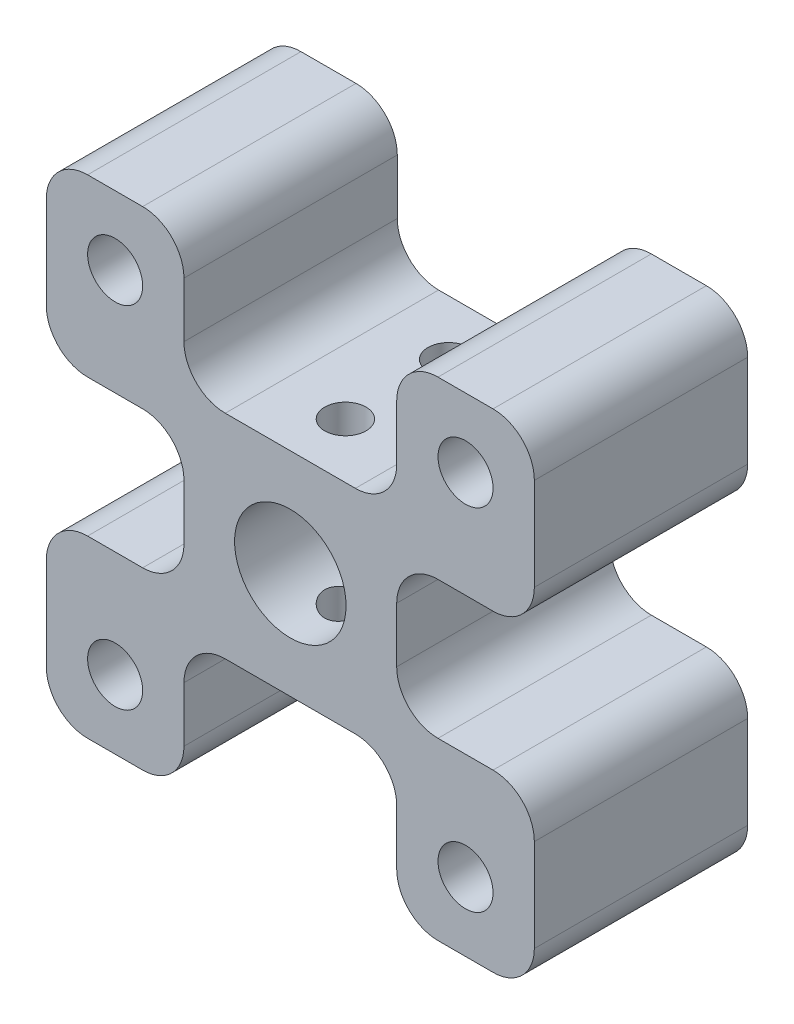
from build123d import *

# Parameters (mm, degrees)
SKETCH_1_R          = 2
SKETCH_1_R_2        = 4.05
EXTRUDE_1_DEPTH     = 15.5
FILLET_3_R          = 3
SKETCH_3_R          = 1.5
CUT_EXTRUDE_2_DEPTH = 35.677503091


with BuildPart() as part:
    # ｽｹｯﾁ1 → ﾎﾞｽ - 押し出し1 (new body)
    with BuildSketch(Plane.XY):
        Polygon((-7.727922061, 17.727922061), (-7.727922061, 7.727922061), (7.727922061, 7.727922061), (7.727922061, 17.727922061), (17.727922061, 17.727922061), (17.727922061, 5), (7.727922061, 5), (7.727922061, -5), (17.727922061, -5), (17.727922061, -17.727922061), (7.727922061, -17.727922061), (7.727922061, -7.727922061), (-7.727922061, -7.727922061), (-7.727922061, -17.727922061), (-17.727922061, -17.727922061), (-17.727922061, -5), (-7.727922061, -5), (-7.727922061, 5), (-17.727922061, 5), (-17.727922061, 17.727922061), align=None)
        with Locations((-12.727922061, 12.727922061)):
            Circle(SKETCH_1_R, mode=Mode.SUBTRACT)
        with Locations((12.727922061, 12.727922061)):
            Circle(SKETCH_1_R, mode=Mode.SUBTRACT)
        with Locations((12.727922061, -12.727922061)):
            Circle(SKETCH_1_R, mode=Mode.SUBTRACT)
        with Locations((-12.727922061, -12.727922061)):
            Circle(SKETCH_1_R, mode=Mode.SUBTRACT)
        Circle(SKETCH_1_R_2, mode=Mode.SUBTRACT)
    extrude(amount=EXTRUDE_1_DEPTH)

    # ﾌｨﾚｯﾄ3
    fillet_3_edges = [part.edges().sort_by_distance(p)[0] for p in [
        (-17.727922061, 17.727922061, 7.75),
        (-7.727922061, 17.727922061, 7.75),
        (-7.727922061, 7.727922061, 7.75),
        (7.727922061, 7.727922061, 7.75),
        (7.727922061, 17.727922061, 7.75),
        (17.727922061, 17.727922061, 7.75),
        (17.727922061, 5, 7.75),
        (7.727922061, 5, 7.75),
        (7.727922061, -5, 7.75),
        (17.727922061, -5, 7.75),
        (17.727922061, -17.727922061, 7.75),
        (7.727922061, -17.727922061, 7.75),
        (7.727922061, -7.727922061, 7.75),
        (-7.727922061, -7.727922061, 7.75),
        (-7.727922061, -17.727922061, 7.75),
        (-17.727922061, -17.727922061, 7.75),
        (-17.727922061, -5, 7.75),
        (-7.727922061, -5, 7.75),
        (-7.727922061, 5, 7.75),
        (-17.727922061, 5, 7.75),
    ]]
    fillet(fillet_3_edges, radius=FILLET_3_R)

    # ｽｹｯﾁ3 → ｶｯﾄ - 押し出し2 (cut, through all)
    with BuildSketch(Plane(origin=(0, 7.727922061, 0), x_dir=(1, 0, 0), z_dir=(0, 1, 0))):
        with Locations(Location((0, -4, 0), (0, 0, 270))):
            Circle(SKETCH_3_R)
        with Locations(Location((0, -11.5, 0), (0, 0, 270))):
            Circle(SKETCH_3_R)
    extrude(amount=-CUT_EXTRUDE_2_DEPTH, mode=Mode.SUBTRACT)


solid = part.part
